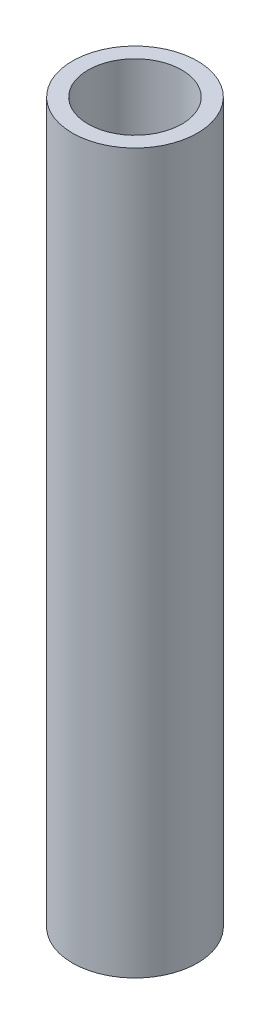
from build123d import *

# Parameters (mm, degrees)
SKETCH1_R           = 4
SKETCH1_R_2         = 3
BOSS_EXTRUDE1_DEPTH = 23


with BuildPart() as part:
    # Sketch1 → Boss-Extrude1 (new, symmetric)
    with BuildSketch(Plane(origin=(0, 0, 0), x_dir=(1, 0, 0), z_dir=(0, 1, 0))):
        with Locations(Location((0, 0, 0), (0, 0, 270))):
            Circle(SKETCH1_R)
        with Locations(Location((0, 0, 0), (0, 0, 270))):
            Circle(SKETCH1_R_2, mode=Mode.SUBTRACT)
    extrude(amount=BOSS_EXTRUDE1_DEPTH, both=True)


solid = part.part
